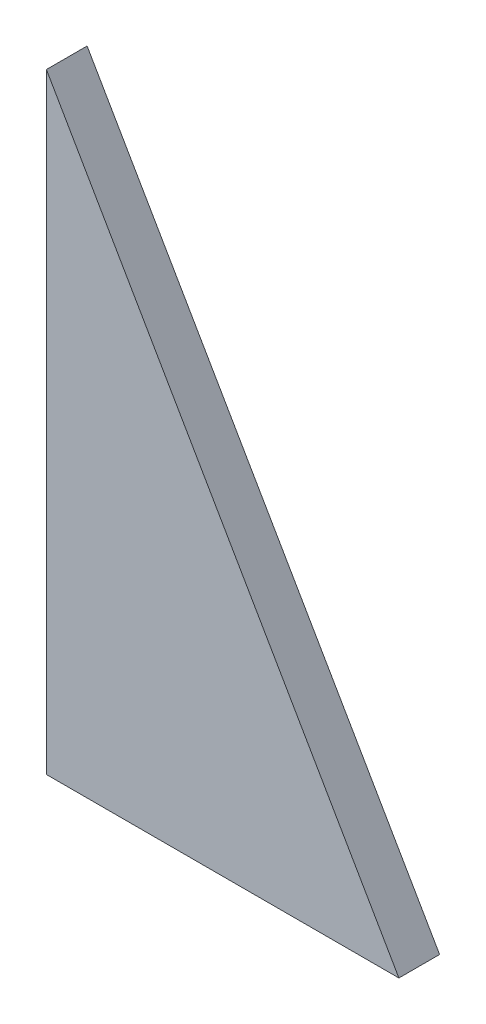
from build123d import *

# Parameters (mm, degrees)
SALIENTE_EXTRUIR1_DEPTH = 1


with BuildPart() as part:
    # Croquis1 → Saliente-Extruir1 (new body)
    with BuildSketch(Plane.XY):
        Polygon((0, 0), (-8.660254038, 15), (-8.660254038, 0), (-2.206147984, 0), align=None)
    extrude(amount=SALIENTE_EXTRUIR1_DEPTH)


solid = part.part
